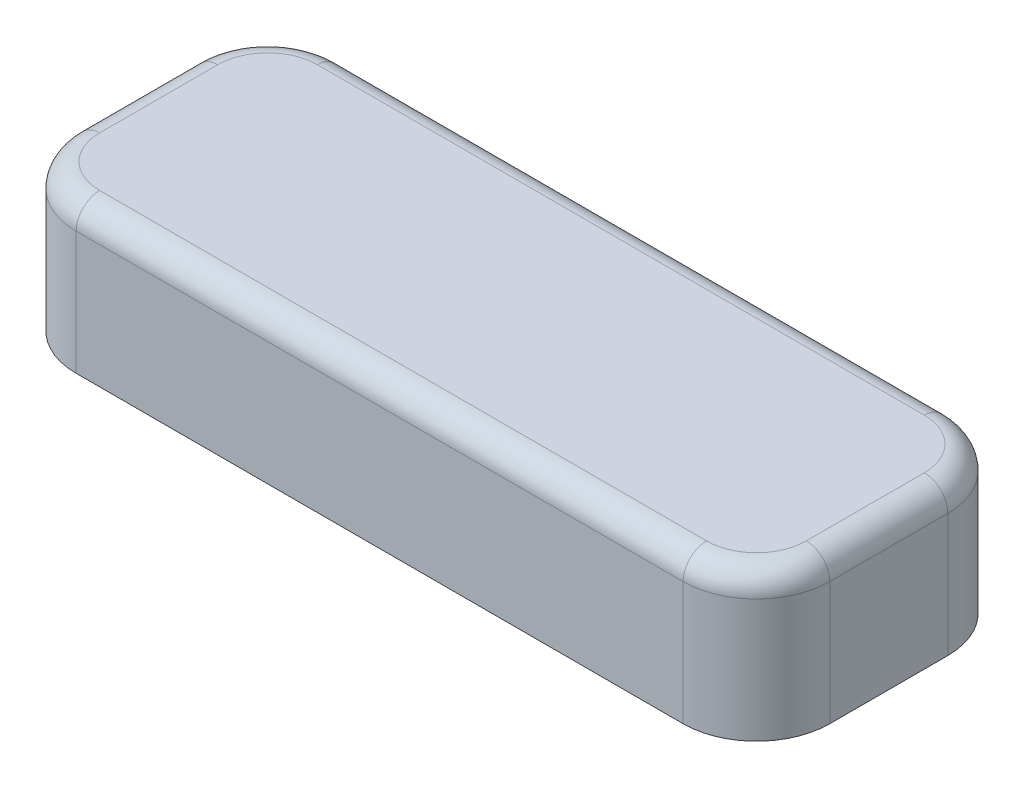
from build123d import *

# Parameters (mm, degrees)
SKETCH_1_R        = 2.8
EXTRUDE_1_DEPTH   = 8
EXTRUDE_1_2_DEPTH = 8
EXTRUDE_1_3_DEPTH = 8
SKETCH_2_W        = 51.3875
SKETCH_2_H        = 18.05
EXTRUDE_2_DEPTH   = 1
SKETCH_3_W        = 51.3875
SKETCH_3_H        = 18.05
SKETCH_3_W_2      = 49.3875
SKETCH_3_H_2      = 16.05
EXTRUDE_3_DEPTH   = 9
SKETCH_4_W        = 7.50625
SKETCH_4_H        = 1.2
SKETCH_4_W_2      = 1.2
SKETCH_4_H_2      = 5.825
SKETCH_4_W_3      = 10.5875
EXTRUDE_4_DEPTH   = 2.5
FILLET_1_R        = 5
FILLET_2_R        = 1.6


with BuildPart() as part:
    # 草图1 → 凸台-拉伸1 (new body)
    with BuildSketch(Plane(origin=(0, 0, 0), x_dir=(1, 0, 0), z_dir=(0, 1, 0))):
        with Locations(Location((0, 0, 0), (0, 0, 270))):
            Circle(SKETCH_1_R)
        Polygon((2.2, 0.6), (2.2, -0.6), (0.6, -0.6), (0.6, -2.2), (-0.6, -2.2), (-0.6, -0.6), (-2.2, -0.6), (-2.2, 0.6), (-0.6, 0.6), (-0.6, 2.2), (0.6, 2.2), (0.6, 0.6), align=None, mode=Mode.SUBTRACT)
    extrude(amount=-EXTRUDE_1_DEPTH)

    # 草图2 → 凸台-拉伸2 (add)
    with BuildSketch(Plane(origin=(0, 0, 0), x_dir=(1, 0, 0), z_dir=(0, 1, 0))):
        Rectangle(SKETCH_2_W, SKETCH_2_H)
    extrude(amount=EXTRUDE_2_DEPTH)

    # 草图3 → 凸台-拉伸3 (add)
    with BuildSketch(Plane(origin=(0, 0, 0), x_dir=(1, 0, 0), z_dir=(0, 1, 0))):
        Rectangle(SKETCH_3_W, SKETCH_3_H)
        Rectangle(SKETCH_3_W_2, SKETCH_3_H_2, mode=Mode.SUBTRACT)
    extrude(amount=-EXTRUDE_3_DEPTH)



with BuildPart() as body_2:
    # 草图1 → Extrude 1 2 (new body)
    with BuildSketch(Plane(origin=(0, 0, 0), x_dir=(1, 0, 0), z_dir=(0, 1, 0))):
        with Locations(Location((-11.90625, 0, 0), (0, 0, 270))):
            Circle(SKETCH_1_R)
        Polygon((-14.10625, -0.6), (-14.10625, 0.6), (-12.50625, 0.6), (-12.50625, 2.2), (-11.30625, 2.2), (-11.30625, 0.6), (-9.70625, 0.6), (-9.70625, -0.6), (-11.30625, -0.6), (-11.30625, -2.2), (-12.50625, -2.2), (-12.50625, -0.6), align=None, mode=Mode.SUBTRACT)
    extrude(amount=-EXTRUDE_1_2_DEPTH)


with BuildPart() as body_3:
    # 草图1 → Extrude 1 3 (new body)
    with BuildSketch(Plane(origin=(0, 0, 0), x_dir=(1, 0, 0), z_dir=(0, 1, 0))):
        with Locations(Location((11.90625, 0, 0), (0, 0, 270))):
            Circle(SKETCH_1_R)
        Polygon((9.70625, 0.6), (9.70625, -0.6), (11.30625, -0.6), (11.30625, -2.2), (12.50625, -2.2), (12.50625, -0.6), (14.10625, -0.6), (14.10625, 0.6), (12.50625, 0.6), (12.50625, 2.2), (11.30625, 2.2), (11.30625, 0.6), align=None, mode=Mode.SUBTRACT)
    extrude(amount=-EXTRUDE_1_3_DEPTH)


with BuildPart() as part_1:
    add(part.part)

    add(body_2.part)  # 凸台-拉伸4 merges body 2

    add(body_3.part)  # 凸台-拉伸4 merges body 3
    # 草图4 → 凸台-拉伸4 (add)
    with BuildSketch(Plane(origin=(0, 0, 0), x_dir=(1, 0, 0), z_dir=(0, 1, 0))):
        with Locations((5.953125, 0)):
            Rectangle(SKETCH_4_W, SKETCH_4_H)
        with Locations((11.90625, 5.1125)):
            Rectangle(SKETCH_4_W_2, SKETCH_4_H_2)
        with Locations((11.90625, -5.1125)):
            Rectangle(SKETCH_4_W_2, SKETCH_4_H_2)
        with Locations((19.4, 0)):
            Rectangle(SKETCH_4_W_3, SKETCH_4_H)
        with Locations((0, 5.1125)):
            Rectangle(SKETCH_4_W_2, SKETCH_4_H_2)
        with Locations((-5.953125, 0)):
            Rectangle(SKETCH_4_W, SKETCH_4_H)
        with Locations((0, -5.1125)):
            Rectangle(SKETCH_4_W_2, SKETCH_4_H_2)
        with Locations((-11.90625, 5.1125)):
            Rectangle(SKETCH_4_W_2, SKETCH_4_H_2)
        with Locations((-11.90625, -5.1125)):
            Rectangle(SKETCH_4_W_2, SKETCH_4_H_2)
        with Locations((-19.4, 0)):
            Rectangle(SKETCH_4_W_3, SKETCH_4_H)
    extrude(amount=-EXTRUDE_4_DEPTH)

    # 圆角1
    fillet_1_edges = [part_1.edges().sort_by_distance(p)[0] for p in [
        (25.69375, -4, 9.025),
        (25.69375, -4, -9.025),
        (-25.69375, -4, -9.025),
        (-25.69375, -4, 9.025),
        (-24.69375, -4.5, 8.025),
        (-24.69375, -4.5, -8.025),
        (24.69375, -4.5, -8.025),
        (24.69375, -4.5, 8.025),
    ]]
    fillet(fillet_1_edges, radius=FILLET_1_R)

    # 圆角2
    fillet_2_edges = [part_1.edges().sort_by_distance(p)[0] for p in [
        (5.953125, 0, -8.025),
        (16.1, 0, 8.025),
        (24.69375, 0, -1.8125),
        (-5.953125, 0, -8.025),
        (5.953125, 0, 8.025),
        (-16.1, 0, -8.025),
        (-5.953125, 0, 8.025),
        (-24.69375, 0, 1.8125),
        (-25.69375, 1, 0),
        (0, 1, -9.025),
        (25.69375, 1, 0),
        (0, 1, 9.025),
        (-24.229283906, 1, 7.560533906),
        (24.229283906, 1, 7.560533906),
        (24.229283906, 1, -7.560533906),
        (-24.229283906, 1, -7.560533906),
        (-24.69375, 0, -1.8125),
        (-23.229283906, 0, -6.560533906),
        (16.1, 0, -8.025),
        (23.229283906, 0, -6.560533906),
        (24.69375, 0, 1.8125),
        (23.229283906, 0, 6.560533906),
        (-16.1, 0, 8.025),
        (-23.229283906, 0, 6.560533906),
    ]]
    fillet(fillet_2_edges, radius=FILLET_2_R)


solid = part_1.part
